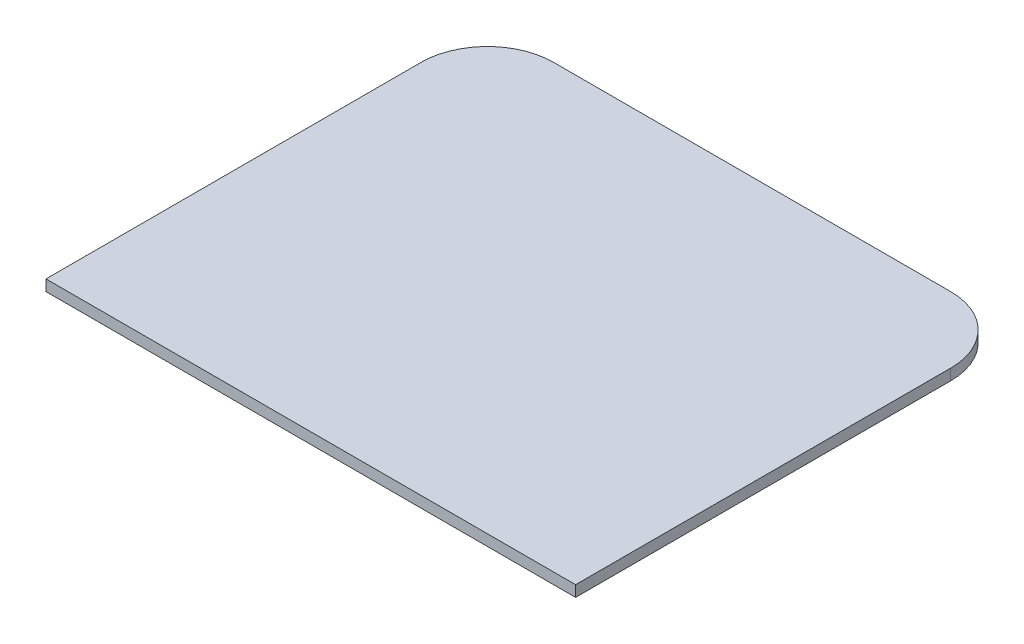
from build123d import *

# Parameters (mm, degrees)
SKETCH1_W           = 152.4
SKETCH1_H           = 127
BOSS_EXTRUDE1_DEPTH = 3.175
FILLET1_R           = 19.05
FILLET2_R           = 19.05


with BuildPart() as part:
    # Sketch1 → Boss-Extrude1 (new body)
    with BuildSketch(Plane(origin=(0, 0, 0), x_dir=(1, 0, 0), z_dir=(0, 1, 0))):
        with Locations((18.650008827, -2.416687905)):
            Rectangle(SKETCH1_W, SKETCH1_H)
    extrude(amount=BOSS_EXTRUDE1_DEPTH)

    # Fillet1
    fillet1_edges = [part.edges().sort_by_distance(p)[0] for p in [
        (-57.549991173, 1.5875, -61.083312095),
    ]]
    fillet(fillet1_edges, radius=FILLET1_R)

    # Fillet2
    fillet2_edges = [part.edges().sort_by_distance(p)[0] for p in [
        (94.850008827, 1.5875, -61.083312095),
    ]]
    fillet(fillet2_edges, radius=FILLET2_R)


solid = part.part
